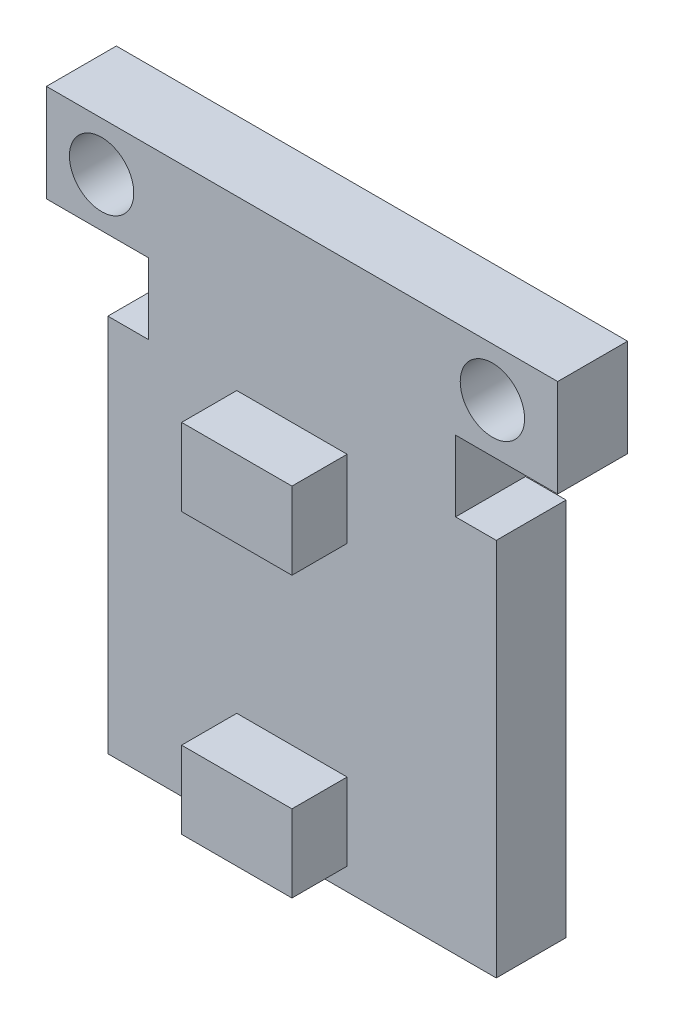
from build123d import *

# Parameters (mm, degrees)
SKETCH1_R           = 1.75
BOSS_EXTRUDE1_DEPTH = 3.8
SKETCH2_W           = 6
SKETCH2_H           = 4.2
BOSS_EXTRUDE2_DEPTH = 3
CUT_EXTRUDE1_DEPTH  = 1.2


with BuildPart() as part:
    # Sketch1 → Boss-Extrude1 (new body)
    with BuildSketch(Plane.XY):
        Polygon((-13.9, 0), (13.9, 0), (13.9, -5.3), (8.35, -5.3), (8.35, -9.15), (10.56, -9.15), (10.56, -29.76), (9.69, -29.76), (-10.56, -29.76), (-10.56, -9.15), (-8.35, -9.15), (-8.35, -5.3), (-13.9, -5.3), align=None)
        with Locations(Location((-10.9, -2.65, 0), (0, 0, 180))):
            Circle(SKETCH1_R, mode=Mode.SUBTRACT)
        with Locations(Location((10.35, -2.65, 0), (0, 0, 180))):
            Circle(SKETCH1_R, mode=Mode.SUBTRACT)
    extrude(amount=BOSS_EXTRUDE1_DEPTH)

    # Sketch2 → Boss-Extrude2 (add)
    with BuildSketch(Plane.XY.offset(3.8)):
        with Locations((-0.55, -11.25)):
            Rectangle(SKETCH2_W, SKETCH2_H)
        with Locations((-0.55, -26.45)):
            Rectangle(SKETCH2_W, SKETCH2_H)
    extrude(amount=BOSS_EXTRUDE2_DEPTH)

    # Sketch3 → Cut-Extrude1 (cut)
    # profile 1 of 10: a face of its own
    with BuildSketch(Plane(origin=(0, 0, 0), x_dir=(-1, 0, 0), z_dir=(0, 0, -1))):
        with BuildLine():
            add(Edge.make_bspline(
                [(-6.741761552, -15.054045758), (-6.676953446, -15.055687237), (-6.549664979, -15.058911238), (-6.362590081, -15.083590342), (-6.183994986, -15.126285732), (-6.012424847, -15.183148714), (-5.849931871, -15.259003099), (-5.695292978, -15.350688248), (-5.548876105, -15.459164707), (-5.412654723, -15.583593933), (-5.287997773, -15.718977387), (-5.178171886, -15.863455297), (-5.086129593, -16.0161541), (-5.010543806, -16.17661493), (-4.951245196, -16.344474898), (-4.910326152, -16.520628901), (-4.884188002, -16.703935591), (-4.881132225, -16.828962456), (-4.879582065, -16.892387104)],
                knots=[0, 0, 0, 0, 1.065120563, 2.091984664, 3.0946048, 4.079830382, 5.057816894, 6.036188127, 7.030412546, 8.04752943, 9.064399622, 10.05169764, 11.02544977, 11.989514704, 12.962713494, 13.945757189, 14.957906945, 16, 16, 16, 16], degree=3))
            add(Edge.make_bspline(
                [(-4.879582065, -16.892387104), (-4.881131997, -16.95534455), (-4.884187094, -17.079440971), (-4.910355872, -17.261584415), (-4.951396872, -17.436675111), (-5.009993138, -17.604420764), (-5.085218616, -17.764998328), (-5.177873787, -17.917985282), (-5.287014998, -18.06343178), (-5.411221849, -18.199744445), (-5.546622891, -18.324741916), (-5.691853158, -18.433660792), (-5.843646478, -18.527384916), (-6.003956186, -18.60216859), (-6.170656223, -18.661940511), (-6.345238546, -18.702693141), (-6.5268851, -18.728980184), (-6.650756104, -18.7319987), (-6.71371668, -18.733532937)],
                knots=[0, 0, 0, 0, 1.043624062, 2.057103931, 3.04512605, 4.022047818, 4.998200453, 5.980619268, 6.982898556, 8.009068085, 9.034988726, 10.034168286, 11.015286542, 11.987931943, 12.962482838, 13.94673481, 14.956375938, 16, 16, 16, 16], degree=3))
            add(Edge.make_bspline(
                [(-6.71371668, -18.733532937), (-6.777140999, -18.73198355), (-6.902167215, -18.728929296), (-7.085704251, -18.702747892), (-7.261981994, -18.661806588), (-7.430496346, -18.603297152), (-7.591341275, -18.527679921), (-7.744831358, -18.435475542), (-7.890350505, -18.326068401), (-8.026692252, -18.201901826), (-8.15144145, -18.066730274), (-8.260200826, -17.921896019), (-8.352425939, -17.770240562), (-8.427789271, -17.611343038), (-8.487453731, -17.445971596), (-8.528158549, -17.273023118), (-8.554494501, -17.093483612), (-8.557529347, -16.971240714), (-8.559069244, -16.909214027)],
                knots=[0, 0, 0, 0, 1.053102029, 2.075944431, 3.073151272, 4.055350789, 5.033113405, 6.020478099, 7.024410459, 8.052272461, 9.079885166, 10.07527673, 11.055994387, 12.023226415, 12.992069828, 13.970394897, 14.97016774, 16, 16, 16, 16], degree=3))
            add(Edge.make_bspline(
                [(-8.559069244, -16.909214027), (-8.558534609, -16.867581358), (-8.557472083, -16.784841234), (-8.54468039, -16.661974634), (-8.526118689, -16.541083976), (-8.499516776, -16.422513028), (-8.464725109, -16.306552044), (-8.423673082, -16.192401281), (-8.373533237, -16.081217557), (-8.316852589, -15.972474165), (-8.253590781, -15.86786626), (-8.183715031, -15.768986676), (-8.109679663, -15.67500568), (-8.028516269, -15.588358676), (-7.942899824, -15.506525019), (-7.851441446, -15.430762302), (-7.754699201, -15.360387351), (-7.652256822, -15.29696701), (-7.546638547, -15.239607876), (-7.437761769, -15.190386025), (-7.327105197, -15.148139963), (-7.214150549, -15.113899138), (-7.099197777, -15.086867102), (-6.981995993, -15.068459748), (-6.862638566, -15.055635431), (-6.782227248, -15.054577929), (-6.741761552, -15.054045758)],
                knots=[0, 0, 0, 0, 1.037015668, 2.060948919, 3.074880161, 4.083647147, 5.086022904, 6.090072063, 7.104153813, 8.122640571, 9.144368836, 10.147691507, 11.138137339, 12.123020368, 13.103399296, 14.087645067, 15.080126199, 16.082011238, 17.087798457, 18.072939717, 19.057185487, 20.037253025, 21.01195951, 21.997135196, 22.992090687, 24, 24, 24, 24], degree=3))
        make_face()
        with BuildLine():
            add(Edge.make_bspline(
                [(-6.726336873, -15.413020117), (-6.759551506, -15.413425007), (-6.825663239, -15.414230917), (-6.923947775, -15.424846632), (-7.020939709, -15.439976521), (-7.116659071, -15.461558042), (-7.210705361, -15.490962095), (-7.303955202, -15.524803003), (-7.395558256, -15.566024094), (-7.485212114, -15.612596798), (-7.572127189, -15.664145719), (-7.65413989, -15.721117486), (-7.731462534, -15.78217604), (-7.803905801, -15.847463877), (-7.871256973, -15.917313479), (-7.934841674, -15.990665915), (-7.992111256, -16.069617806), (-8.044596833, -16.152028213), (-8.091564673, -16.237789794), (-8.133330028, -16.325999657), (-8.167494037, -16.417377343), (-8.195356413, -16.510931501), (-8.218456224, -16.606513961), (-8.233090148, -16.70484981), (-8.243822507, -16.805444922), (-8.244582353, -16.873426776), (-8.24496668, -16.907811783)],
                knots=[0, 0, 0, 0, 1.008559885, 2.007477868, 2.99961109, 3.989939068, 4.984837346, 5.991145699, 7.001802488, 8.033829008, 9.059044045, 10.069351652, 11.065060232, 12.050310815, 13.029377138, 14.011219647, 14.996725999, 15.989392538, 16.977580475, 17.965360261, 18.951710183, 19.937753436, 20.929683414, 21.935841486, 22.955955122, 24, 24, 24, 24], degree=3))
            add(Edge.make_bspline(
                [(-8.24496668, -16.907811783), (-8.243691818, -16.958374004), (-8.24118377, -17.057845534), (-8.2192262, -17.203613678), (-8.185404226, -17.343701965), (-8.135546859, -17.477343874), (-8.073196245, -17.605688157), (-7.996169355, -17.727596262), (-7.904910269, -17.843101136), (-7.801246742, -17.951396405), (-7.687924036, -18.050242209), (-7.567591306, -18.137005618), (-7.441537698, -18.210415868), (-7.309434496, -18.27022094), (-7.171986957, -18.317610678), (-7.028309406, -18.350089309), (-6.879358946, -18.371464764), (-6.777828291, -18.37351752), (-6.726336873, -18.374558578)],
                knots=[0, 0, 0, 0, 1.032063989, 2.030389145, 3.003944642, 3.970395727, 4.937377036, 5.913328081, 6.909231446, 7.93887556, 8.970685674, 9.976071282, 10.964166581, 11.944589148, 12.933237628, 13.927779006, 14.949070134, 16, 16, 16, 16], degree=3))
            add(Edge.make_bspline(
                [(-6.726336873, -18.374558578), (-6.691727371, -18.374083074), (-6.623086335, -18.373140006), (-6.520990812, -18.363641329), (-6.420734601, -18.34840946), (-6.322458321, -18.326478804), (-6.226273509, -18.299031598), (-6.131778706, -18.26642387), (-6.039980416, -18.225742666), (-5.949720578, -18.180794714), (-5.863324336, -18.129554557), (-5.780848804, -18.074516407), (-5.704372824, -18.013547787), (-5.631983753, -17.949229974), (-5.564356064, -17.880266126), (-5.50194708, -17.806745904), (-5.444966947, -17.728205247), (-5.392501301, -17.645919841), (-5.345698038, -17.559923589), (-5.304918939, -17.471393911), (-5.270322823, -17.380548801), (-5.242394318, -17.28725723), (-5.220508857, -17.191696381), (-5.205428937, -17.093738303), (-5.194880498, -16.99357896), (-5.194085421, -16.925835104), (-5.193684629, -16.891685982)],
                knots=[0, 0, 0, 0, 1.047197238, 2.076906641, 3.100256066, 4.114471768, 5.12198147, 6.126382909, 7.136867548, 8.15857795, 9.17633901, 10.174870724, 11.156907918, 12.133735059, 13.104061851, 14.077631395, 15.04955518, 16.038496417, 17.029181396, 18.010275684, 18.986308667, 19.968651475, 20.955262928, 21.950658345, 22.966943676, 24, 24, 24, 24], degree=3))
            add(Edge.make_bspline(
                [(-5.193684629, -16.891685982), (-5.194085742, -16.857770478), (-5.194881423, -16.790492828), (-5.205423898, -16.691032009), (-5.220524788, -16.593778798), (-5.242287496, -16.499114995), (-5.27033765, -16.40701647), (-5.304924981, -16.317569722), (-5.34571028, -16.230441527), (-5.392518504, -16.14584723), (-5.445134328, -16.064672492), (-5.502628571, -15.987070079), (-5.565993919, -15.914497338), (-5.633419944, -15.845162644), (-5.70659083, -15.780544755), (-5.785175124, -15.720622234), (-5.868218801, -15.66394896), (-5.956146037, -15.612823398), (-6.046889991, -15.565609165), (-6.140003949, -15.525158162), (-6.234433048, -15.490786042), (-6.329937161, -15.461469077), (-6.427320139, -15.440061047), (-6.525923968, -15.424832997), (-6.625612226, -15.414234612), (-6.692655446, -15.413426233), (-6.726336873, -15.413020117)],
                knots=[0, 0, 0, 0, 1.02996197, 2.043119294, 3.035359645, 4.018872909, 4.991431989, 5.957985074, 6.929999688, 7.912076566, 8.892894881, 9.867085534, 10.843653904, 11.817741046, 12.803660682, 13.806313499, 14.818574707, 15.856120519, 16.894564902, 17.924820532, 18.937903209, 19.946497019, 20.957711757, 21.963978472, 22.977135795, 24, 24, 24, 24], degree=3))
        make_face(mode=Mode.SUBTRACT)
    # profile 2 of 10: a face of its own
    with BuildSketch(Plane(origin=(0, 0, 0), x_dir=(-1, 0, 0), z_dir=(0, 0, -1))):
        Polygon((-4.161633347, -15.143789348), (-3.847530783, -15.143789348), (-3.847530783, -18.284814989), (-2.501376937, -18.284814989), (-2.501376937, -18.643789348), (-4.161633347, -18.643789348), align=None)
    # profile 3 of 10: a face of its own
    with BuildSketch(Plane(origin=(0, 0, 0), x_dir=(-1, 0, 0), z_dir=(0, 0, -1))):
        Polygon((-1.918043603, -15.143789348), (0.056315371, -15.143789348), (0.056315371, -15.502763706), (-1.603941039, -15.502763706), (-1.603941039, -16.579686783), (0.056315371, -16.579686783), (0.056315371, -16.938661142), (-1.603941039, -16.938661142), (-1.603941039, -18.284814989), (0.056315371, -18.284814989), (0.056315371, -18.643789348), (-1.918043603, -18.643789348), align=None)
    # profile 4 of 10: a face of its own
    with BuildSketch(Plane(origin=(0, 0, 0), x_dir=(-1, 0, 0), z_dir=(0, 0, -1))):
        with BuildLine():
            Line((0.684520499, -18.643789348), (0.684520499, -15.143789348))
            Line((0.684520499, -15.143789348), (1.391251268, -15.143789348))
            add(Edge.make_bspline(
                [(1.391251268, -15.143789348), (1.452720257, -15.144231917), (1.571478022, -15.14508696), (1.743090469, -15.150508352), (1.901874232, -15.160098817), (2.047307091, -15.174068344), (2.179788303, -15.191221377), (2.298946911, -15.212721782), (2.405399054, -15.238109952), (2.470868495, -15.259755402), (2.501828192, -15.269991271)],
                knots=[0, 0, 0, 0, 1.314313732, 2.53924729, 3.670748893, 4.714932338, 5.66265055, 6.526160246, 7.303039223, 8, 8, 8, 8], degree=3))
            add(Edge.make_bspline(
                [(2.501828192, -15.269991271), (2.542322931, -15.285421976), (2.622394123, -15.31593347), (2.736401246, -15.373489772), (2.843726609, -15.438702873), (2.944945754, -15.511658736), (3.03774658, -15.594423085), (3.125754477, -15.68348017), (3.2053692, -15.78206851), (3.278277496, -15.888143498), (3.344013156, -16.000455551), (3.401152314, -16.118790659), (3.448606307, -16.242547867), (3.487999534, -16.371383015), (3.519045991, -16.505579393), (3.540227923, -16.645293259), (3.554198913, -16.789972449), (3.555602964, -16.888146912), (3.556315371, -16.937960021)],
                knots=[0, 0, 0, 0, 0.984719456, 1.947108742, 2.898477687, 3.838006223, 4.779231079, 5.722358779, 6.681677486, 7.655904652, 8.64651281, 9.637519902, 10.640069247, 11.656948941, 12.698408672, 13.768548281, 14.867775369, 16, 16, 16, 16], degree=3))
            add(Edge.make_bspline(
                [(3.556315371, -16.937960021), (3.555686404, -16.981221259), (3.554446957, -17.066472048), (3.543317642, -17.192112944), (3.527141321, -17.314026515), (3.502097124, -17.431632215), (3.47169461, -17.545960433), (3.432730459, -17.655792677), (3.388094963, -17.762136487), (3.336045084, -17.863553962), (3.278903699, -17.959637335), (3.217581956, -18.050212863), (3.152145261, -18.133988085), (3.081969628, -18.211216697), (3.007961911, -18.281782275), (2.929637581, -18.346274291), (2.84679453, -18.403430845), (2.759803807, -18.455497954), (2.666127678, -18.500918309), (2.563991812, -18.539348319), (2.452960634, -18.571194934), (2.333306677, -18.59776583), (2.204823199, -18.618843133), (2.067384233, -18.632969525), (1.921200944, -18.642522458), (1.820821678, -18.643358851), (1.769155916, -18.643789348)],
                knots=[0, 0, 0, 0, 1.105936401, 2.179363191, 3.223086493, 4.248585256, 5.251745608, 6.245858792, 7.225916811, 8.198733463, 9.158002045, 10.082870192, 10.993790845, 11.873723703, 12.748670949, 13.606408763, 14.465103618, 15.319838547, 16.196477973, 17.123216899, 18.106603292, 19.147568657, 20.255746949, 21.433717677, 22.679120308, 24, 24, 24, 24], degree=3))
            Line((1.769155916, -18.643789348), (0.684520499, -18.643789348))
        make_face()
        with BuildLine():
            Line((0.998623063, -18.284814989), (1.400365852, -18.284814989))
            add(Edge.make_bspline(
                [(1.400365852, -18.284814989), (1.458094223, -18.284566892), (1.569127021, -18.284089712), (1.728785018, -18.279902509), (1.874664415, -18.273060571), (2.006785924, -18.263485494), (2.125074948, -18.250816878), (2.229778698, -18.236691976), (2.320553957, -18.219094525), (2.375483394, -18.203143565), (2.400866653, -18.195772521)],
                knots=[0, 0, 0, 0, 1.375205317, 2.645023457, 3.804390687, 4.853969522, 5.800190428, 6.637939096, 7.370582563, 8, 8, 8, 8], degree=3))
            add(Edge.make_bspline(
                [(2.400866653, -18.195772521), (2.432815015, -18.184520962), (2.495948653, -18.162286589), (2.586829739, -18.121728928), (2.671586743, -18.073686858), (2.751696768, -18.020284584), (2.826023424, -17.959638582), (2.89544754, -17.893067593), (2.959829342, -17.820232818), (3.01850365, -17.741224657), (3.071011954, -17.656534861), (3.116483183, -17.566996027), (3.156334715, -17.473589217), (3.187613307, -17.374880059), (3.212128891, -17.271751), (3.229493579, -17.164194787), (3.240308304, -17.052231505), (3.241569752, -16.976079381), (3.242212807, -16.937258899)],
                knots=[0, 0, 0, 0, 0.998632004, 1.973411704, 2.929992603, 3.868527914, 4.809262121, 5.754881198, 6.702106254, 7.672490631, 8.653608572, 9.636854334, 10.631411391, 11.644891563, 12.686317036, 13.754757253, 14.855430412, 16, 16, 16, 16], degree=3))
            add(Edge.make_bspline(
                [(3.242212807, -16.937258899), (3.24169952, -16.896325418), (3.240691162, -16.815911234), (3.228016852, -16.697920539), (3.209495296, -16.584439888), (3.18271161, -16.475461693), (3.148580731, -16.370773341), (3.105986089, -16.270953831), (3.05731947, -16.174948962), (2.999416133, -16.084974596), (2.93600054, -15.999881487), (2.865622661, -15.921926571), (2.789400622, -15.850932271), (2.708165773, -15.785792958), (2.619628673, -15.729129282), (2.525874983, -15.678442601), (2.425529311, -15.63542671), (2.355716616, -15.612547847), (2.320237647, -15.600920758)],
                knots=[0, 0, 0, 0, 1.122418816, 2.205001699, 3.251619955, 4.274784885, 5.280384055, 6.268708349, 7.249350384, 8.229342522, 9.199999885, 10.157847722, 11.105861043, 12.055065948, 13.010012805, 13.98527497, 14.976112212, 16, 16, 16, 16], degree=3))
            add(Edge.make_bspline(
                [(2.320237647, -15.600920758), (2.2908865, -15.59280433), (2.22847791, -15.575546577), (2.126638446, -15.556721205), (2.012023297, -15.540116706), (1.884123595, -15.526058666), (1.743085136, -15.515971345), (1.588799448, -15.50840003), (1.421199844, -15.503293398), (1.30501731, -15.502944691), (1.244716813, -15.502763706)],
                knots=[0, 0, 0, 0, 0.674548936, 1.434276114, 2.292660221, 3.240891867, 4.284742987, 5.42552168, 6.663806718, 8, 8, 8, 8], degree=3))
            Line((1.244716813, -15.502763706), (0.998623063, -15.502763706))
            Line((0.998623063, -15.502763706), (0.998623063, -18.284814989))
        make_face(mode=Mode.SUBTRACT)
    # profile 5 of 10: a face of its own
    with BuildSketch(Plane(origin=(0, 0, 0), x_dir=(-1, 0, 0), z_dir=(0, 0, -1))):
        with BuildLine():
            Line((-8.738556424, -24.801942392), (-8.442683026, -24.624558578))
            add(Edge.make_bspline(
                [(-8.442683026, -24.624558578), (-8.415164789, -24.670622963), (-8.362440909, -24.758880547), (-8.274489549, -24.878138588), (-8.183356638, -24.979500744), (-8.088367305, -25.062377352), (-7.990101357, -25.127626239), (-7.887917303, -25.17382847), (-7.782159492, -25.202644446), (-7.710185671, -25.206144532), (-7.674253539, -25.207891912)],
                knots=[0, 0, 0, 0, 1.272034388, 2.437168799, 3.508375237, 4.49857839, 5.41946034, 6.295179144, 7.148887113, 8, 8, 8, 8], degree=3))
            add(Edge.make_bspline(
                [(-7.674253539, -25.207891912), (-7.643566679, -25.207037239), (-7.582729906, -25.205342849), (-7.493167663, -25.189062047), (-7.40618586, -25.164049918), (-7.323577223, -25.128228986), (-7.246481608, -25.084890501), (-7.178874913, -25.032544323), (-7.1204288, -24.973938117), (-7.072619685, -24.908555463), (-7.03593965, -24.838238314), (-7.007747581, -24.766062363), (-6.992102508, -24.690893795), (-6.989745754, -24.640283332), (-6.988556424, -24.614742873)],
                knots=[0, 0, 0, 0, 1.095163259, 2.171163733, 3.241058638, 4.321873601, 5.38011039, 6.391990106, 7.366004449, 8.327778327, 9.272591725, 10.192022065, 11.087607919, 12, 12, 12, 12], degree=3))
            add(Edge.make_bspline(
                [(-6.988556424, -24.614742873), (-6.990030735, -24.585602023), (-6.993027793, -24.526362934), (-7.018359273, -24.438963281), (-7.05820852, -24.352470711), (-7.094971163, -24.298969446), (-7.114057225, -24.271193194)],
                knots=[0, 0, 0, 0, 0.938893495, 1.908633276, 2.914225137, 4, 4, 4, 4], degree=3))
            add(Edge.make_bspline(
                [(-7.114057225, -24.271193194), (-7.129727839, -24.25114637), (-7.162626334, -24.209060571), (-7.219183846, -24.146415336), (-7.285549961, -24.081796917), (-7.359453515, -24.01273786), (-7.443586604, -23.942450063), (-7.535314119, -23.867581785), (-7.636977978, -23.790980208), (-7.708277474, -23.739607643), (-7.745066841, -23.713100245)],
                knots=[0, 0, 0, 0, 0.722233717, 1.516239348, 2.393582979, 3.351407094, 4.387010283, 5.505090956, 6.712668013, 8, 8, 8, 8], degree=3))
            add(Edge.make_bspline(
                [(-7.745066841, -23.713100245), (-7.781890837, -23.686871657), (-7.852295513, -23.636724595), (-7.950754096, -23.562300311), (-8.038798559, -23.494256442), (-8.116037575, -23.431952429), (-8.182437172, -23.375379825), (-8.238520583, -23.325081886), (-8.28285914, -23.279698325), (-8.307514721, -23.250256983), (-8.318584469, -23.237038546)],
                knots=[0, 0, 0, 0, 1.452282411, 2.77665338, 3.964542531, 5.026858415, 5.96415736, 6.766646006, 7.446254459, 8, 8, 8, 8], degree=3))
            add(Edge.make_bspline(
                [(-8.318584469, -23.237038546), (-8.334057014, -23.216437509), (-8.364485851, -23.175922806), (-8.404651856, -23.112597948), (-8.438791019, -23.047774682), (-8.465553351, -22.981278818), (-8.48808957, -22.914043889), (-8.503247501, -22.845192643), (-8.512738898, -22.775034025), (-8.513710884, -22.727820524), (-8.51419745, -22.704185982)],
                knots=[0, 0, 0, 0, 1.068054152, 2.10047183, 3.106115577, 4.101338837, 5.06977816, 6.043150881, 7.020423561, 8, 8, 8, 8], degree=3))
            add(Edge.make_bspline(
                [(-8.51419745, -22.704185982), (-8.512892241, -22.667156208), (-8.51030972, -22.593888144), (-8.488469203, -22.486857313), (-8.45399631, -22.384670896), (-8.405701422, -22.288340562), (-8.343444069, -22.200374582), (-8.271398094, -22.119761095), (-8.185586608, -22.051992512), (-8.091433985, -21.992780454), (-7.988377613, -21.946434529), (-7.880386709, -21.911473549), (-7.767289637, -21.891664291), (-7.690686503, -21.888821526), (-7.651817642, -21.887379091)],
                knots=[0, 0, 0, 0, 1.005424448, 1.989358655, 2.955360095, 3.929531133, 4.905563448, 5.876582895, 6.856512386, 7.866279853, 8.892233794, 9.918561126, 10.94386622, 12, 12, 12, 12], degree=3))
            add(Edge.make_bspline(
                [(-7.651817642, -21.887379091), (-7.610573542, -21.888801643), (-7.52855219, -21.891630644), (-7.407902974, -21.916228175), (-7.291742258, -21.956928847), (-7.198298993, -22.003117505), (-7.125166232, -22.049248921), (-7.069393499, -22.091268745), (-7.012876048, -22.139643853), (-6.955157993, -22.1945031), (-6.897217334, -22.256349851), (-6.838193882, -22.32476054), (-6.777949613, -22.399317095), (-6.739193753, -22.452541596), (-6.719325655, -22.479827008)],
                knots=[0, 0, 0, 0, 1.286793592, 2.559021753, 3.825965368, 5.121522368, 5.803751409, 6.523245864, 7.299691795, 8.125521123, 9.008227632, 9.944561021, 10.946284179, 12, 12, 12, 12], degree=3))
            Line((-6.719325655, -22.479827008), (-7.003279982, -22.695071399))
            add(Edge.make_bspline(
                [(-7.003279982, -22.695071399), (-7.020425914, -22.672982708), (-7.053444971, -22.630445055), (-7.103574458, -22.57087374), (-7.150823106, -22.51645726), (-7.197373506, -22.469192132), (-7.240767137, -22.426489999), (-7.282884179, -22.389930242), (-7.323118531, -22.359154646), (-7.373835441, -22.326311086), (-7.43755316, -22.293754583), (-7.517537696, -22.266205505), (-7.601123971, -22.249650443), (-7.658053602, -22.247461555), (-7.686873732, -22.24635345)],
                knots=[0, 0, 0, 0, 1.181633172, 2.275549214, 3.290209073, 4.226197932, 5.078386478, 5.862611352, 6.581680152, 7.217281963, 8.414376989, 9.595101626, 10.782541182, 12, 12, 12, 12], degree=3))
            add(Edge.make_bspline(
                [(-7.686873732, -22.24635345), (-7.723030254, -22.24756515), (-7.792754701, -22.249901799), (-7.891744937, -22.275421785), (-7.980838863, -22.315603645), (-8.057391428, -22.371918623), (-8.121128405, -22.438639616), (-8.167233863, -22.515418471), (-8.194984028, -22.600200873), (-8.198370308, -22.65934253), (-8.200094885, -22.689462424)],
                knots=[0, 0, 0, 0, 1.14458467, 2.207223713, 3.21896685, 4.227309161, 5.202851033, 6.127160689, 7.046193047, 8, 8, 8, 8], degree=3))
            add(Edge.make_bspline(
                [(-8.200094885, -22.689462424), (-8.199701759, -22.708213903), (-8.198914863, -22.745747522), (-8.187940065, -22.801198944), (-8.173840736, -22.856510284), (-8.151498104, -22.911432867), (-8.120652801, -22.966927226), (-8.080147625, -23.023948963), (-8.029134313, -23.083000672), (-7.9900573, -23.121408046), (-7.969425815, -23.141685982)],
                knots=[0, 0, 0, 0, 0.858281714, 1.717966888, 2.583508476, 3.4729293, 4.427298488, 5.488583878, 6.674047936, 8, 8, 8, 8], degree=3))
            add(Edge.make_bspline(
                [(-7.969425815, -23.141685982), (-7.961764442, -23.148523008), (-7.943562775, -23.164766216), (-7.91028685, -23.191358497), (-7.866344051, -23.224161269), (-7.81288185, -23.264748586), (-7.748914488, -23.311830048), (-7.674434932, -23.36480366), (-7.5902734, -23.425389119), (-7.530551484, -23.46774666), (-7.498973091, -23.490143514)],
                knots=[0, 0, 0, 0, 0.420754252, 0.999615792, 1.744751191, 2.668019286, 3.750313428, 4.999500688, 6.413464383, 8, 8, 8, 8], degree=3))
            add(Edge.make_bspline(
                [(-7.498973091, -23.490143514), (-7.460987177, -23.517784874), (-7.387432721, -23.571308535), (-7.282775141, -23.651724215), (-7.187881333, -23.730371984), (-7.102418129, -23.806749591), (-7.025541221, -23.880277684), (-6.9581035, -23.951840865), (-6.89941782, -24.020926437), (-6.836238601, -24.109499013), (-6.771680782, -24.218280097), (-6.716239274, -24.351558336), (-6.681280927, -24.485354656), (-6.676709412, -24.575281493), (-6.67445386, -24.619650726)],
                knots=[0, 0, 0, 0, 1.163667725, 2.253281268, 3.268753668, 4.215851969, 5.092017293, 5.902905408, 6.650798638, 7.335211899, 8.59617414, 9.77448103, 10.901945474, 12, 12, 12, 12], degree=3))
            add(Edge.make_bspline(
                [(-6.67445386, -24.619650726), (-6.675110998, -24.651029091), (-6.676412513, -24.713176474), (-6.691373427, -24.804431551), (-6.713293092, -24.893062421), (-6.746330326, -24.977973533), (-6.786653484, -25.060718296), (-6.837819732, -25.139126196), (-6.897127417, -25.214932595), (-6.965161182, -25.286116086), (-7.039607084, -25.351462282), (-7.118290779, -25.409591344), (-7.201341052, -25.458059667), (-7.288307368, -25.497610509), (-7.379209705, -25.528544027), (-7.474017489, -25.550956896), (-7.572887, -25.564712607), (-7.640087482, -25.566140368), (-7.674253539, -25.566866271)],
                knots=[0, 0, 0, 0, 0.983748083, 1.948392443, 2.894712957, 3.844097841, 4.80183111, 5.778335162, 6.776009319, 7.81870978, 8.863265674, 9.881300176, 10.883814829, 11.87499822, 12.874611388, 13.892143829, 14.928324115, 16, 16, 16, 16], degree=3))
            add(Edge.make_bspline(
                [(-7.674253539, -25.566866271), (-7.700688882, -25.566355089), (-7.753226642, -25.565339164), (-7.830936124, -25.556357883), (-7.907075713, -25.54365078), (-7.980689995, -25.52347671), (-8.052727407, -25.498999733), (-8.122874642, -25.4688614), (-8.191165695, -25.432744199), (-8.257983278, -25.391449174), (-8.323157453, -25.343391429), (-8.386076921, -25.287417933), (-8.448806106, -25.225072428), (-8.509493503, -25.154661865), (-8.569366647, -25.077323782), (-8.627245056, -24.992334598), (-8.684326774, -24.900157245), (-8.720142242, -24.835292159), (-8.738556424, -24.801942392)],
                knots=[0, 0, 0, 0, 0.915332311, 1.819136955, 2.706846663, 3.586547465, 4.459518054, 5.340707479, 6.227863349, 7.133153174, 8.059268498, 9.028702269, 10.047606654, 11.120612155, 12.245963614, 13.433783089, 14.680604001, 16, 16, 16, 16], degree=3))
        make_face()
    # profile 6 of 10: a face of its own
    with BuildSketch(Plane(origin=(0, 0, 0), x_dir=(-1, 0, 0), z_dir=(0, 0, -1))):
        with BuildLine():
            Line((-2.725735911, -22.619350245), (-3.000575655, -22.829686783))
            add(Edge.make_bspline(
                [(-3.000575655, -22.829686783), (-3.020181543, -22.806320814), (-3.05912899, -22.759903898), (-3.121788192, -22.694724353), (-3.187089835, -22.633659092), (-3.255008956, -22.576417212), (-3.326768076, -22.525000447), (-3.400628875, -22.476729344), (-3.47782692, -22.433461606), (-3.584578654, -22.38099862), (-3.724226503, -22.326252465), (-3.900021342, -22.280349233), (-4.08353244, -22.251128058), (-4.20873004, -22.247963216), (-4.272410591, -22.24635345)],
                knots=[0, 0, 0, 0, 0.757959112, 1.505699292, 2.245454638, 2.979532153, 3.711538275, 4.438200793, 5.171680507, 5.909471876, 7.393775596, 8.890124382, 10.418191784, 12, 12, 12, 12], degree=3))
            add(Edge.make_bspline(
                [(-4.272410591, -22.24635345), (-4.30749389, -22.246757413), (-4.377334882, -22.247561588), (-4.480983356, -22.258170714), (-4.582696407, -22.273081924), (-4.682407873, -22.295207247), (-4.779990832, -22.323179866), (-4.876083234, -22.35660528), (-4.969293834, -22.39796012), (-5.060912072, -22.44366838), (-5.148691283, -22.495295824), (-5.231746331, -22.551609176), (-5.309774299, -22.611978273), (-5.382836911, -22.676629379), (-5.451008859, -22.74527134), (-5.51379617, -22.818635681), (-5.57098158, -22.896487855), (-5.623698605, -22.977801262), (-5.670911339, -23.062339054), (-5.710441218, -23.150414124), (-5.74544634, -23.240518227), (-5.773145583, -23.333669388), (-5.7950701, -23.429212154), (-5.810197763, -23.527402942), (-5.820686234, -23.628036622), (-5.821486411, -23.696245934), (-5.821889757, -23.73062829)],
                knots=[0, 0, 0, 0, 1.054917814, 2.100044995, 3.131103042, 4.146048494, 5.169673617, 6.183595914, 7.203665975, 8.234915748, 9.262203917, 10.264457458, 11.251630812, 12.227803204, 13.197192746, 14.159520551, 15.12972552, 16.100847026, 17.073214652, 18.039054194, 19.002613845, 19.979014051, 20.95965708, 21.949030935, 22.966165397, 24, 24, 24, 24], degree=3))
            add(Edge.make_bspline(
                [(-5.821889757, -23.73062829), (-5.820627938, -23.78235961), (-5.818150524, -23.883927195), (-5.79610219, -24.032697805), (-5.762597099, -24.175218479), (-5.712381522, -24.310598321), (-5.650462471, -24.440506679), (-5.57222186, -24.562745533), (-5.481605322, -24.679162097), (-5.377330903, -24.787005045), (-5.262925087, -24.88551877), (-5.140177175, -24.972269352), (-5.009392887, -25.044584234), (-4.872016257, -25.104760181), (-4.726990143, -25.151016908), (-4.574575341, -25.183581032), (-4.415103346, -25.204823212), (-4.306133946, -25.2068569), (-4.250675815, -25.207891912)],
                knots=[0, 0, 0, 0, 1.029171465, 2.020641659, 2.987623507, 3.938342917, 4.889210282, 5.84687017, 6.821220943, 7.821438502, 8.827599549, 9.822697543, 10.807740252, 11.797342354, 12.80366471, 13.83203677, 14.896651826, 16, 16, 16, 16], degree=3))
            add(Edge.make_bspline(
                [(-4.250675815, -25.207891912), (-4.189573126, -25.206203132), (-4.069308417, -25.202879209), (-3.892940391, -25.17471996), (-3.724104625, -25.129062042), (-3.562792038, -25.06516412), (-3.409457392, -24.982098832), (-3.263860732, -24.881400955), (-3.125879161, -24.762112622), (-3.042907879, -24.671029494), (-3.000575655, -24.624558578)],
                knots=[0, 0, 0, 0, 1.028121516, 2.023589091, 2.998037872, 3.967518031, 4.937445131, 5.927275754, 6.942489185, 8, 8, 8, 8], degree=3))
            Line((-3.000575655, -24.624558578), (-2.725735911, -24.832791751))
            add(Edge.make_bspline(
                [(-2.725735911, -24.832791751), (-2.747854021, -24.861330203), (-2.791984296, -24.91827041), (-2.863442313, -24.998542119), (-2.938719611, -25.074046155), (-3.018375321, -25.144173776), (-3.101493112, -25.210328242), (-3.189565425, -25.270630073), (-3.281434457, -25.325920957), (-3.376788936, -25.376547882), (-3.475527549, -25.421465129), (-3.577531984, -25.459918896), (-3.682362559, -25.493043786), (-3.790024068, -25.520295723), (-3.900739824, -25.541566807), (-4.014110299, -25.555786481), (-4.130380174, -25.565528396), (-4.208821595, -25.566416312), (-4.24857245, -25.566866271)],
                knots=[0, 0, 0, 0, 0.986787822, 1.968848986, 2.935600012, 3.899624008, 4.868462664, 5.837806735, 6.815139263, 7.798259679, 8.787526145, 9.778297419, 10.776456485, 11.791383307, 12.812564526, 13.85620153, 14.913611965, 16, 16, 16, 16], degree=3))
            add(Edge.make_bspline(
                [(-4.24857245, -25.566866271), (-4.286216117, -25.566604278), (-4.360651807, -25.56608622), (-4.470550558, -25.557694053), (-4.577540139, -25.546244316), (-4.681314765, -25.529004185), (-4.78244074, -25.508659845), (-4.880001324, -25.481388588), (-4.974956535, -25.450839422), (-5.066924876, -25.414934435), (-5.155984575, -25.374418252), (-5.241848387, -25.328626693), (-5.324476819, -25.277944829), (-5.40468224, -25.223489818), (-5.481279824, -25.163512516), (-5.554933349, -25.098845882), (-5.626055825, -25.029707871), (-5.67005851, -24.979853018), (-5.692182225, -24.954786944)],
                knots=[0, 0, 0, 0, 1.114604814, 2.203992996, 3.262667896, 4.300477797, 5.318619304, 6.316056647, 7.298880507, 8.271930387, 9.238335007, 10.195173496, 11.151986948, 12.108099108, 13.064862484, 14.031167946, 15.010108607, 16, 16, 16, 16], degree=3))
            add(Edge.make_bspline(
                [(-5.692182225, -24.954786944), (-5.727617869, -24.911245755), (-5.798061345, -24.824689044), (-5.888187029, -24.684403063), (-5.965334584, -24.537934854), (-6.027710505, -24.384514925), (-6.076473238, -24.224487538), (-6.110254433, -24.057772024), (-6.132206038, -23.884524082), (-6.134716327, -23.766687293), (-6.135992321, -23.706790149)],
                knots=[0, 0, 0, 0, 0.994628077, 1.977248131, 2.950237994, 3.925870899, 4.908910175, 5.911660606, 6.938484602, 8, 8, 8, 8], degree=3))
            add(Edge.make_bspline(
                [(-6.135992321, -23.706790149), (-6.134437128, -23.643834695), (-6.131377382, -23.519973771), (-6.105381586, -23.338199817), (-6.06356279, -23.164048419), (-6.004165901, -22.997844674), (-5.92886055, -22.838714394), (-5.835833936, -22.687873189), (-5.726166794, -22.544356389), (-5.600719226, -22.410341638), (-5.463151891, -22.287802285), (-5.315833077, -22.179996082), (-5.15905113, -22.090278566), (-4.994533278, -22.015282403), (-4.821047597, -21.95763794), (-4.638964228, -21.917284753), (-4.448625313, -21.892167637), (-4.318762887, -21.888992429), (-4.25277918, -21.887379091)],
                knots=[0, 0, 0, 0, 1.032925535, 2.032216505, 3.007276963, 3.968222605, 4.92396291, 5.891752235, 6.871517503, 7.883894988, 8.900124299, 9.891468569, 10.874487609, 11.85992873, 12.854644235, 13.869047385, 14.917252991, 16, 16, 16, 16], degree=3))
            add(Edge.make_bspline(
                [(-4.25277918, -21.887379091), (-4.212564708, -21.887861229), (-4.132964211, -21.888815573), (-4.015211559, -21.898121715), (-3.900569232, -21.913635322), (-3.78895825, -21.934751391), (-3.679835633, -21.960958713), (-3.574035393, -21.995099011), (-3.470936706, -22.034135543), (-3.371189798, -22.079094008), (-3.275273247, -22.12956075), (-3.183216929, -22.184976373), (-3.09575207, -22.245272179), (-3.012263222, -22.309935354), (-2.934147011, -22.380333914), (-2.859185532, -22.45453151), (-2.789924454, -22.534665334), (-2.747171259, -22.591070268), (-2.725735911, -22.619350245)],
                knots=[0, 0, 0, 0, 1.096760587, 2.17092713, 3.219439832, 4.250915756, 5.268269357, 6.278326846, 7.281116186, 8.274029601, 9.260640565, 10.235837813, 11.203064059, 12.156899882, 13.114053108, 14.069676657, 15.032185724, 16, 16, 16, 16], degree=3))
        make_face()
    # profile 7 of 10: a face of its own
    with BuildSketch(Plane(origin=(0, 0, 0), x_dir=(-1, 0, 0), z_dir=(0, 0, -1))):
        with BuildLine():
            Line((-2.007787193, -21.977122681), (-1.30736652, -21.977122681))
            add(Edge.make_bspline(
                [(-1.30736652, -21.977122681), (-1.260625392, -21.977278267), (-1.170877247, -21.977577009), (-1.042303977, -21.979242772), (-0.92547688, -21.984017128), (-0.82045704, -21.988125711), (-0.727246385, -21.995617653), (-0.645559095, -22.0027783), (-0.575771397, -22.01215196), (-0.533525546, -22.020857383), (-0.51439777, -22.024798963)],
                knots=[0, 0, 0, 0, 1.410062039, 2.707475311, 3.878576406, 4.937260626, 5.877586885, 6.699081471, 7.410979367, 8, 8, 8, 8], degree=3))
            add(Edge.make_bspline(
                [(-0.51439777, -22.024798963), (-0.488791146, -22.031125728), (-0.438124156, -22.043644292), (-0.36517409, -22.070103893), (-0.295659766, -22.100723517), (-0.229869942, -22.136687238), (-0.168134151, -22.178262017), (-0.10981584, -22.22473014), (-0.054650377, -22.275837346), (-0.004868747, -22.332872187), (0.042070305, -22.392708697), (0.081658932, -22.457412454), (0.115785411, -22.525073981), (0.142955928, -22.596381399), (0.164833902, -22.670643171), (0.180260141, -22.748531967), (0.189511329, -22.829692943), (0.190453184, -22.885050851), (0.190930756, -22.913120277)],
                knots=[0, 0, 0, 0, 1.027469482, 2.033020251, 3.019912614, 3.986113645, 4.951240523, 5.91722682, 6.890402269, 7.87763091, 8.8651537, 9.85103654, 10.82876324, 11.815024772, 12.821070561, 13.842952187, 14.906261191, 16, 16, 16, 16], degree=3))
            add(Edge.make_bspline(
                [(0.190930756, -22.913120277), (0.189461758, -22.959755382), (0.186595362, -23.050752549), (0.159870258, -23.182813431), (0.116093738, -23.306002746), (0.055770449, -23.420165383), (-0.021049026, -23.523076029), (-0.113373818, -23.613466484), (-0.221255429, -23.689106397), (-0.321684745, -23.741559201), (-0.410398945, -23.77515211), (-0.483432257, -23.798788469), (-0.563099235, -23.817050434), (-0.64863657, -23.833410566), (-0.740400225, -23.84576226), (-0.838170264, -23.854808855), (-0.942016416, -23.860462904), (-1.013355485, -23.861304908), (-1.050054821, -23.861738065)],
                knots=[0, 0, 0, 0, 1.260483769, 2.459530307, 3.627416485, 4.787058657, 5.939039949, 7.08810263, 8.267026773, 9.491475466, 10.141966685, 10.831826277, 11.566392101, 12.351337768, 13.187381173, 14.07005841, 15.007169909, 16, 16, 16, 16], degree=3))
            Line((-1.050054821, -23.861738065), (0.23580255, -25.477122681))
            Line((0.23580255, -25.477122681), (-0.152618924, -25.477122681))
            Line((-0.152618924, -25.477122681), (-1.438476296, -23.861738065))
            Line((-1.438476296, -23.861738065), (-1.693684629, -23.861738065))
            Line((-1.693684629, -23.861738065), (-1.693684629, -25.477122681))
            Line((-1.693684629, -25.477122681), (-2.007787193, -25.477122681))
            Line((-2.007787193, -25.477122681), (-2.007787193, -21.977122681))
        make_face()
        with BuildLine():
            Line((-1.693684629, -22.33609704), (-1.693684629, -23.502763706))
            Line((-1.693684629, -23.502763706), (-1.052859308, -23.507671559))
            add(Edge.make_bspline(
                [(-1.052859308, -23.507671559), (-1.02293927, -23.507684796), (-0.964945712, -23.507710452), (-0.881045048, -23.503716676), (-0.802924936, -23.499173358), (-0.730884184, -23.492224012), (-0.664890608, -23.48326794), (-0.604977195, -23.472064956), (-0.551046143, -23.459012893), (-0.488147605, -23.438811268), (-0.417911074, -23.406805249), (-0.341579614, -23.360239751), (-0.276577276, -23.301670632), (-0.221659414, -23.234697175), (-0.177529982, -23.161060927), (-0.146417928, -23.081644557), (-0.126675486, -22.998452959), (-0.12434694, -22.941274852), (-0.123171808, -22.912419155)],
                knots=[0, 0, 0, 0, 1.146690395, 2.22261258, 3.21895312, 4.145990853, 4.996080663, 5.770904154, 6.481378293, 7.121626537, 8.300444488, 9.431385265, 10.535395872, 11.636531494, 12.74115979, 13.810798291, 14.895190096, 16, 16, 16, 16], degree=3))
            add(Edge.make_bspline(
                [(-0.123171808, -22.912419155), (-0.12437393, -22.884272581), (-0.126756095, -22.828496343), (-0.146204863, -22.746840432), (-0.179094245, -22.669773482), (-0.223416483, -22.597608997), (-0.277415638, -22.532103262), (-0.34073345, -22.476056108), (-0.411638646, -22.429806644), (-0.477909844, -22.400252263), (-0.537144056, -22.38213241), (-0.588573716, -22.369381246), (-0.646685194, -22.359136777), (-0.711760653, -22.350928716), (-0.783522284, -22.343873772), (-0.862332935, -22.339121994), (-0.947669715, -22.336308129), (-1.006816646, -22.336169041), (-1.037434629, -22.33609704)],
                knots=[0, 0, 0, 0, 1.101028733, 2.181837193, 3.264309656, 4.369019818, 5.486613113, 6.575447106, 7.666700264, 8.788928104, 9.402425223, 10.0903467, 10.862060571, 11.710948788, 12.657782767, 13.684531032, 14.801375019, 16, 16, 16, 16], degree=3))
            Line((-1.037434629, -22.33609704), (-1.693684629, -22.33609704))
        make_face(mode=Mode.SUBTRACT)
    # profile 8 of 10: a face of its own
    with BuildSketch(Plane(origin=(0, 0, 0), x_dir=(-1, 0, 0), z_dir=(0, 0, -1))):
        Polygon((0.953751268, -21.977122681), (2.928110243, -21.977122681), (2.928110243, -22.33609704), (1.267853833, -22.33609704), (1.267853833, -23.413020117), (2.928110243, -23.413020117), (2.928110243, -23.771994476), (1.267853833, -23.771994476), (1.267853833, -25.118148322), (2.928110243, -25.118148322), (2.928110243, -25.477122681), (0.953751268, -25.477122681), align=None)
    # profile 9 of 10: a face of its own
    with BuildSketch(Plane(origin=(0, 0, 0), x_dir=(-1, 0, 0), z_dir=(0, 0, -1))):
        Polygon((3.556315371, -21.977122681), (5.530674345, -21.977122681), (5.530674345, -22.33609704), (3.870417935, -22.33609704), (3.870417935, -23.413020117), (5.530674345, -23.413020117), (5.530674345, -23.771994476), (3.870417935, -23.771994476), (3.870417935, -25.118148322), (5.530674345, -25.118148322), (5.530674345, -25.477122681), (3.556315371, -25.477122681), align=None)
    # profile 10 of 10: a face of its own
    with BuildSketch(Plane(origin=(0, 0, 0), x_dir=(-1, 0, 0), z_dir=(0, 0, -1))):
        Polygon((6.158879474, -25.477122681), (6.158879474, -21.977122681), (6.224784922, -21.977122681), (8.537084602, -24.731830213), (8.537084602, -21.977122681), (8.851187166, -21.977122681), (8.851187166, -25.477122681), (8.779672743, -25.477122681), (6.472982038, -22.728725245), (6.472982038, -25.477122681), align=None)
    extrude(amount=-CUT_EXTRUDE1_DEPTH, mode=Mode.SUBTRACT)


solid = part.part
